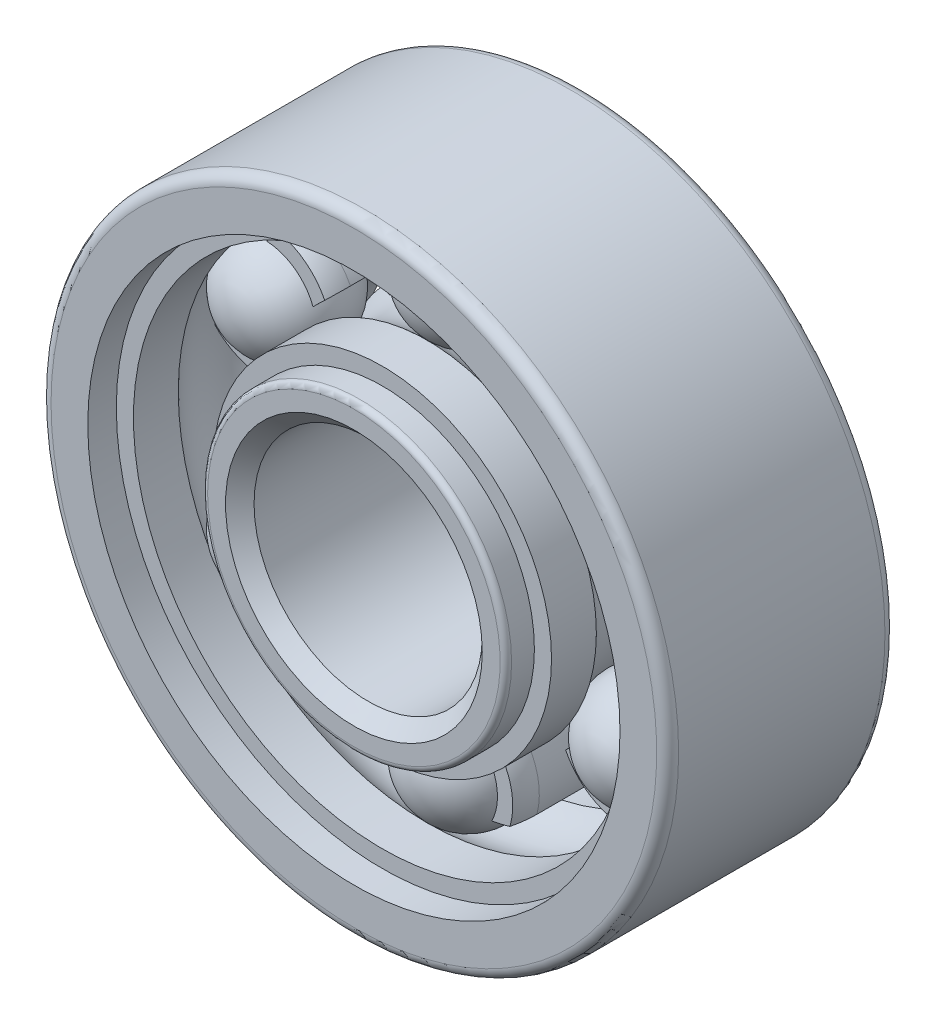
from build123d import *

# Parameters (mm, degrees)
SKETCH3_W               = 6.35
SKETCH3_H               = 1.53035
SKETCH3_H_2             = 1.8034
SKETCH4_R               = 1.5875
SKETCH6_W               = 0.79375
SKETCH6_H               = 3.175
FILLET1_R               = 0.3048
CHAMFER1_SIZE           = 0.396875
FILLET2_R               = 0.15875
CIRPATTERN1_COUNT       = 6
SKETCH9_W               = 0.396875
SKETCH9_H               = 1.5875
CIRPATTERN2_COUNT       = 6
CUT_EXTRUDE1_DEPTH      = 13.749512995
CUT_EXTRUDE1_DEPTH_BACK = 13.749512995
SKETCH10_OUTSIDE_W      = 24.562
SKETCH10_OUTSIDE_H      = 24.562
SKETCH10_OUTSIDE_R      = 6.61035
SKETCH10_OUTSIDE_R_2    = 5.02285


with BuildPart() as part:
    # Sketch3 → Revolve2 (revolve)
    with BuildSketch(Plane(origin=(0, 0, 0), x_dir=(0, 0, -1), z_dir=(1, 0, 0)), mode=Mode.PRIVATE) as revolve2_sk:
        with Locations((0, 3.940175)):
            Rectangle(SKETCH3_W, SKETCH3_H)
        with Locations((0, 7.82955)):
            Rectangle(SKETCH3_W, SKETCH3_H_2)
    revolve(revolve2_sk.sketch.rotate(Axis((0, 0, 3.175), (0, 0, -1)), 90), axis=Axis((0, 0, 3.175), (0, 0, -1)))

    # Sketch4 → Cut-Revolve1 (revolve, cut)
    with BuildSketch(Plane(origin=(0, 0, 0), x_dir=(0, 0, -1), z_dir=(1, 0, 0)), mode=Mode.PRIVATE) as cut_revolve1_sk:
        with Locations((0, 5.8166)):
            Circle(SKETCH4_R)
    revolve(cut_revolve1_sk.sketch.rotate(Axis((0, 0, 3.175), (0, 0, -1)), 90), axis=Axis((0, 0, 3.175), (0, 0, -1)), mode=Mode.SUBTRACT)

    # Sketch6 → Cut-Revolve2 (revolve, cut)
    with BuildSketch(Plane(origin=(0, 0, 0), x_dir=(0, 0, -1), z_dir=(1, 0, 0)), mode=Mode.PRIVATE) as cut_revolve2_sk:
        with Locations((-2.778125, 5.8166)):
            Rectangle(SKETCH6_W, SKETCH6_H)
        with Locations((2.778125, 5.8166)):
            Rectangle(SKETCH6_W, SKETCH6_H)
    revolve(cut_revolve2_sk.sketch.rotate(Axis((0, 0, 3.175), (0, 0, -1)), 90), axis=Axis((0, 0, 3.175), (0, 0, -1)), mode=Mode.SUBTRACT)

    # Fillet1
    fillet1_edges = [part.edges().sort_by_distance(p)[0] for p in [
        (-8.73125, 0, -3.175),
        (-8.73125, 0, 3.175),
    ]]
    fillet(fillet1_edges, radius=FILLET1_R)

    # Chamfer1
    chamfer1_edges = [part.edges().sort_by_distance(p)[0] for p in [
        (-3.175, 0, 3.175),
        (-3.175, 0, -3.175),
    ]]
    chamfer(chamfer1_edges, length=CHAMFER1_SIZE)

    # Fillet2
    fillet2_edges = [part.edges().sort_by_distance(p)[0] for p in [
        (-4.2291, 0, 3.175),
        (-4.2291, 0, -3.175),
    ]]
    fillet(fillet2_edges, radius=FILLET2_R)


with BuildPart() as body_2:
    # Sketch5 → Revolve3 (revolve)
    with BuildSketch(Plane(origin=(0, 0, 0), x_dir=(0, 0, -1), z_dir=(1, 0, 0))):
        with BuildLine():
            Line((-1.5875, 5.8166), (1.5875, 5.8166))
            ThreePointArc((1.5875, 5.8166), (0, 7.4041), (-1.5875, 5.8166))
        make_face()
    revolve(axis=Axis((0, 5.8166, 1.5875), (0, 0, -1)))


with BuildPart() as cirpattern1_1:
    # CirPattern1: pattern copy
    add(body_2.part.rotate(Axis((0, 0, 0), (0, 0, 1)), 1 * 360 / CIRPATTERN1_COUNT))


with BuildPart() as cirpattern1_2:
    # CirPattern1: pattern copy
    add(body_2.part.rotate(Axis((0, 0, 0), (0, 0, 1)), 2 * 360 / CIRPATTERN1_COUNT))


with BuildPart() as cirpattern1_3:
    # CirPattern1: pattern copy
    add(body_2.part.rotate(Axis((0, 0, 0), (0, 0, 1)), 3 * 360 / CIRPATTERN1_COUNT))


with BuildPart() as cirpattern1_4:
    # CirPattern1: pattern copy
    add(body_2.part.rotate(Axis((0, 0, 0), (0, 0, 1)), 4 * 360 / CIRPATTERN1_COUNT))


with BuildPart() as cirpattern1_5:
    # CirPattern1: pattern copy
    add(body_2.part.rotate(Axis((0, 0, 0), (0, 0, 1)), 5 * 360 / CIRPATTERN1_COUNT))


with BuildPart() as body_8:
    # Sketch9 → Revolve4 (revolve)
    with BuildSketch(Plane(origin=(0, 0, 0), x_dir=(0, 0, -1), z_dir=(1, 0, 0)), mode=Mode.PRIVATE) as revolve4_sk:
        with Locations((1.7859375, 5.8166)):
            Rectangle(SKETCH9_W, SKETCH9_H)
    revolve(revolve4_sk.sketch.rotate(Axis((0, 0, 3.175), (0, 0, -1)), 90), axis=Axis((0, 0, 3.175), (0, 0, -1)))

    # Sketch7 → Revolve5 (revolve)
    with BuildSketch(Plane(origin=(0, 0, 0), x_dir=(0, 0, -1), z_dir=(1, 0, 0)), mode=Mode.PRIVATE) as revolve5_sk:
        with BuildLine():
            Line((-0.635, 7.696631686), (-0.635, 7.271567783))
            ThreePointArc((-0.635, 7.271567783), (0.86950956, 7.144797792), (1.5875, 5.8166))
            Line((1.5875, 5.8166), (1.984375, 5.8166))
            Line((1.984375, 5.8166), (1.984375, 7.800975))
            Line((1.984375, 7.800975), (0, 7.800975))
            ThreePointArc((0, 7.800975), (-0.321757878, 7.774715423), (-0.635, 7.696631686))
        make_face()
    revolve5 = revolve(revolve5_sk.sketch.rotate(Axis((0, 5.8166, 1.5875), (0, 0, -1)), 90), axis=Axis((0, 5.8166, 1.5875), (0, 0, -1)))

    # CirPattern2: Revolve5 ×6 about axis
    cirpattern2_axis = Axis((0, 0, 0), (0, 0, 1))
    for i in range(1, CIRPATTERN2_COUNT):
        add(revolve5.rotate(cirpattern2_axis, i * 360 / CIRPATTERN2_COUNT))

    # Sketch10 outside → Cut-Extrude1 (cut, two sides: drawn at the far end of the back side and taken through both)
    # profile 1 of 2: a face of its own
    with BuildSketch(Plane.XY.offset(-CUT_EXTRUDE1_DEPTH_BACK)):
        Rectangle(SKETCH10_OUTSIDE_W, SKETCH10_OUTSIDE_H)
        Circle(SKETCH10_OUTSIDE_R, mode=Mode.SUBTRACT)
    # profile 2 of 2: a face of its own
    with BuildSketch(Plane.XY.offset(-CUT_EXTRUDE1_DEPTH_BACK)):
        Circle(SKETCH10_OUTSIDE_R_2)
    extrude(amount=CUT_EXTRUDE1_DEPTH + CUT_EXTRUDE1_DEPTH_BACK, mode=Mode.SUBTRACT)


solid = Compound([part.part, body_2.part, cirpattern1_1.part, cirpattern1_2.part, cirpattern1_3.part, cirpattern1_4.part, cirpattern1_5.part, body_8.part])
